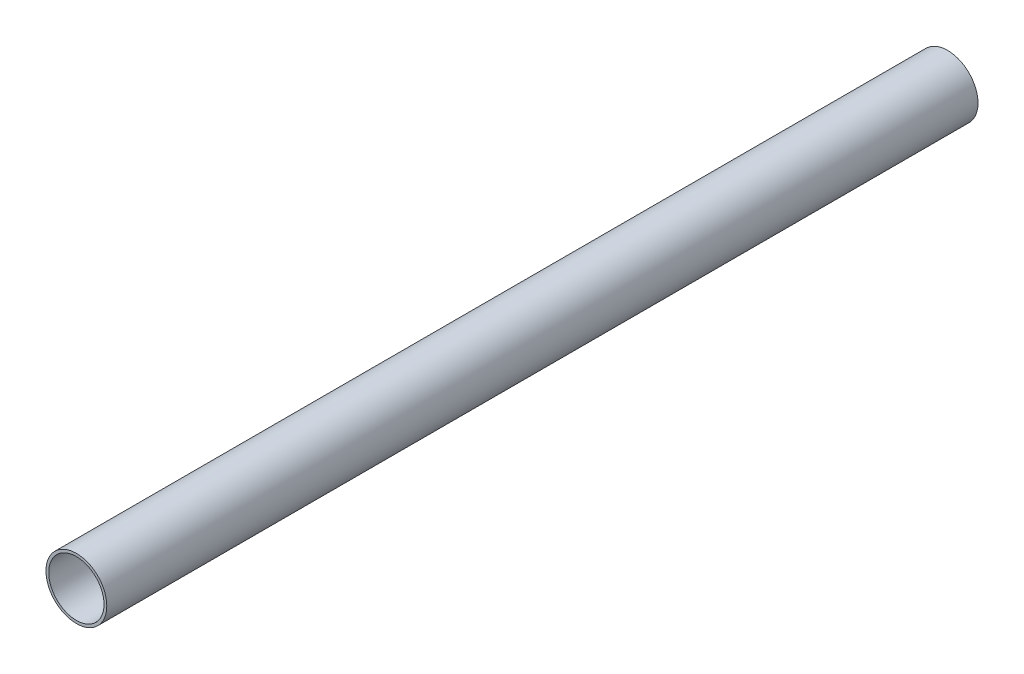
from build123d import *

# Parameters (mm, degrees)
SKETCH_1_R      = 11
SKETCH_1_R_2    = 10
EXTRUDE_1_DEPTH = 157.5


with BuildPart() as part:
    # 草图1 → 凸台-拉伸1 (new, symmetric)
    with BuildSketch(Plane.XY):
        Circle(SKETCH_1_R)
        Circle(SKETCH_1_R_2, mode=Mode.SUBTRACT)
    extrude(amount=EXTRUDE_1_DEPTH, both=True)


solid = part.part
